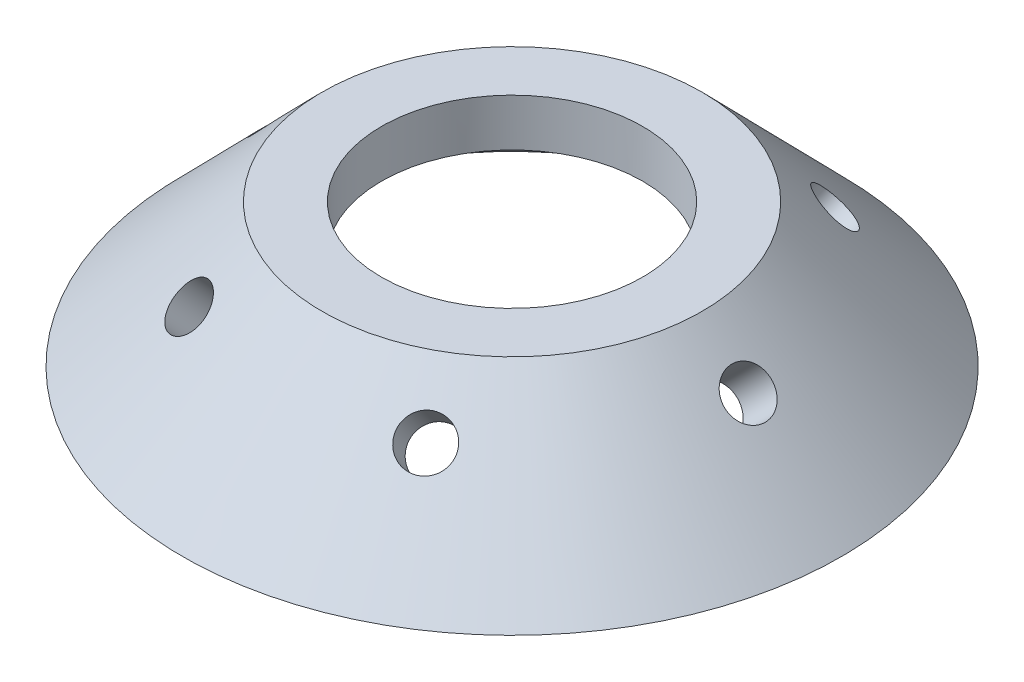
from build123d import *

# Parameters (mm, degrees)
SKETCH11_R         = 13.75
CUT_EXTRUDE1_DEPTH = 52.310379813
SKETCH24_R         = 2.5
CUT_EXTRUDE2_DEPTH = 63.007056159
CIRPATTERN10_COUNT = 6


with BuildPart() as part:
    # Sketch6 → Revolve2 (revolve)
    with BuildSketch(Plane.XY, mode=Mode.PRIVATE) as revolve2_sk:
        Polygon((34.696938457, -15), (20, 0), (0, 0), (0, -5), (17.898979486, -5), (27.696938457, -15), align=None)
    revolve(revolve2_sk.sketch.rotate(Axis((0, -5, 0), (0, 1, 0)), 90), axis=Axis((0, -5, 0), (0, 1, 0)))

    # Sketch11 → Cut-Extrude1 (cut, through all)
    with BuildSketch(Plane(origin=(0, 0, 0), x_dir=(1, 0, 0), z_dir=(0, 1, 0))):
        with Locations(Location((0, 0, 0), (0, 0, 270))):
            Circle(SKETCH11_R)
    extrude(amount=-CUT_EXTRUDE1_DEPTH, mode=Mode.SUBTRACT)

    # Sketch24 → Cut-Extrude2 (cut, through all)
    with BuildSketch(Plane(origin=(10.204081633, 9.997917317, 0), x_dir=(0, 0, -1), z_dir=(0.714285714285714, 0.6998542122237655, 0))):
        with Locations(Location((0, -20.997084244, 0), (0, 0, 318.091872474))):
            Circle(SKETCH24_R)
    cut_extrude2 = extrude(amount=-CUT_EXTRUDE2_DEPTH, mode=Mode.SUBTRACT)

    # CirPattern10: Cut-Extrude2 ×6 about axis
    cirpattern10_axis = Axis((0, -5, 0), (0, -1, 0))
    for i in range(1, CIRPATTERN10_COUNT):
        add(cut_extrude2.rotate(cirpattern10_axis, i * 360 / CIRPATTERN10_COUNT), mode=Mode.SUBTRACT)


solid = part.part
